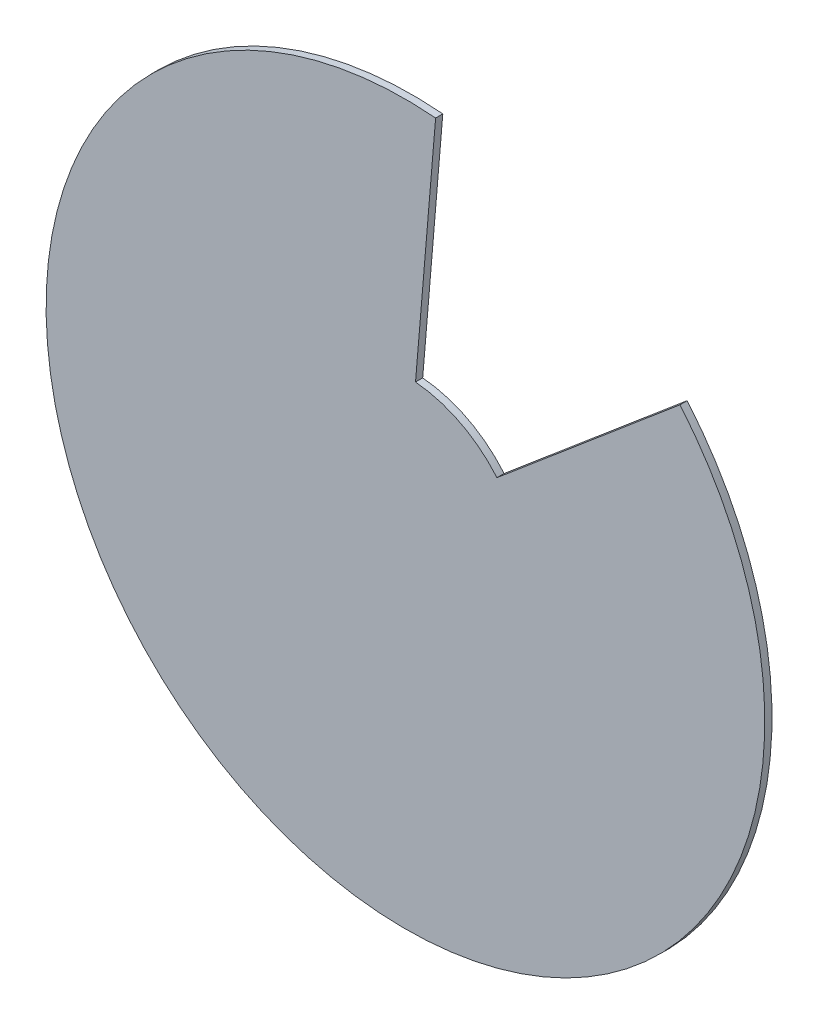
from build123d import *

# Parameters (mm, degrees)
BOSS_EXTRUDE1_DEPTH = 3


with BuildPart() as part:
    # Sketch1 → Boss-Extrude1 (new body)
    with BuildSketch(Plane.XY):
        with BuildLine():
            Line((4.197309328, 49.823514473), (12.591927983, 149.470543418))
            ThreePointArc((12.591927983, 149.470543418), (-68.833325131, -133.274053557), (114.595472503, 96.787797174))
            Line((114.595472503, 96.787797174), (38.198490834, 32.262599058))
            ThreePointArc((38.198490834, 32.262599058), (22.94444171, 44.424684519), (4.197309328, 49.823514473))
        make_face()
    extrude(amount=BOSS_EXTRUDE1_DEPTH)


solid = part.part
